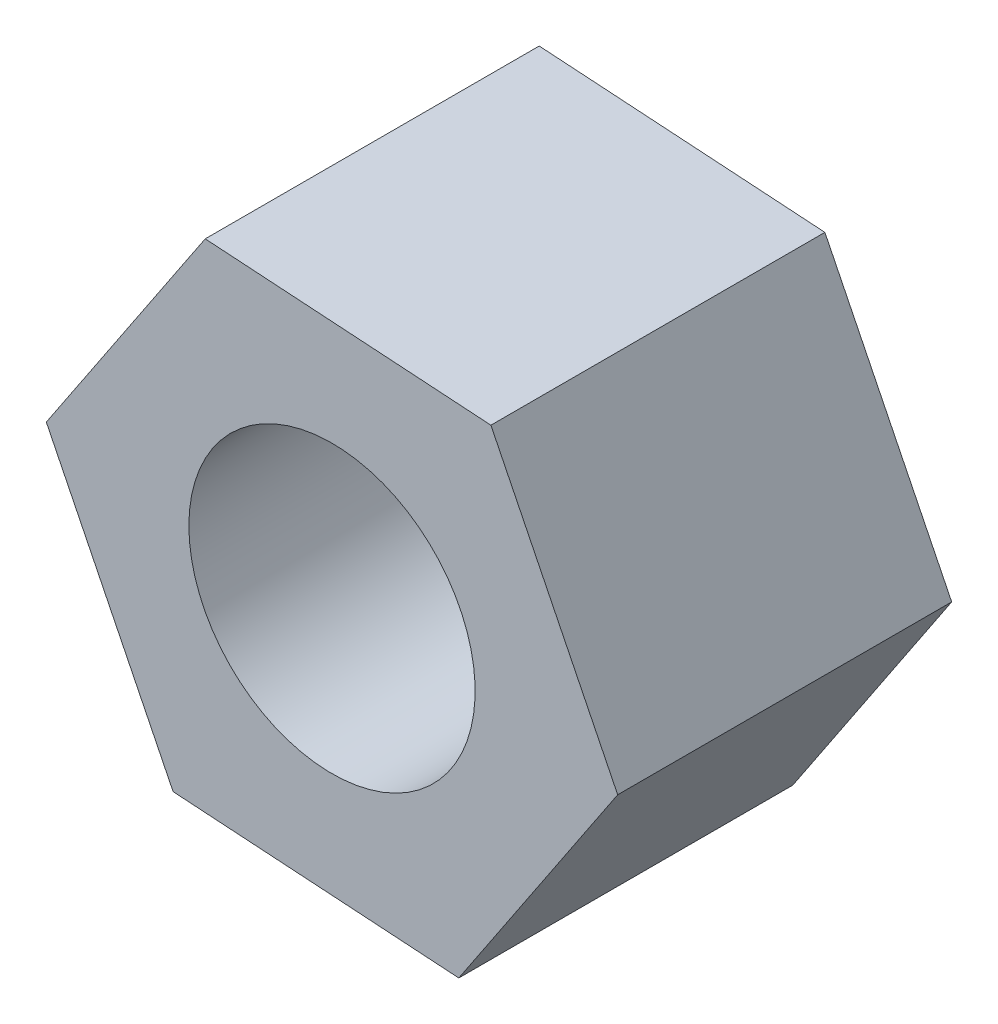
from build123d import *

# Parameters (mm, degrees)
SKETCH1_R           = 30
BOSS_EXTRUDE1_DEPTH = 70


with BuildPart() as part:
    # Sketch1 → Boss-Extrude1 (new body)
    with BuildSketch(Plane.XY):
        Polygon((-59.873990952, 3.886541839), (-33.302839441, -49.909126271), (26.571151511, -53.79566811), (59.873990952, -3.886541839), (33.302839441, 49.909126271), (-26.571151511, 53.79566811), align=None)
        with Locations(Location((0, 0, 0), (0, 0, 180))):
            Circle(SKETCH1_R, mode=Mode.SUBTRACT)
    extrude(amount=BOSS_EXTRUDE1_DEPTH)


solid = part.part
